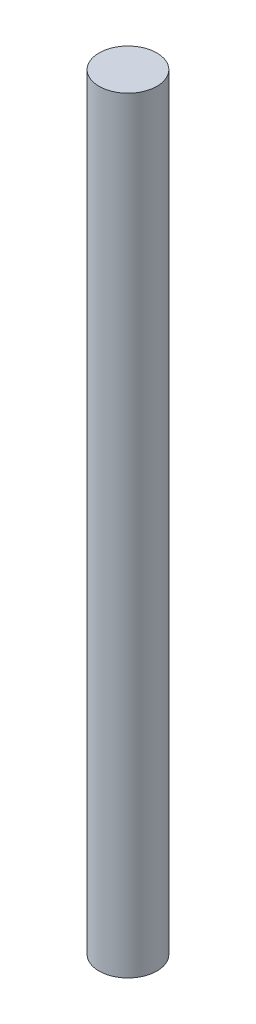
from build123d import *

# Parameters (mm, degrees)
SKETCH_1_R      = 4
EXTRUDE_1_DEPTH = 106


with BuildPart() as part:
    # 草图1 → 凸台-拉伸1 (new body)
    with BuildSketch(Plane(origin=(0, 0, 0), x_dir=(1, 0, 0), z_dir=(0, 1, 0))):
        with Locations(Location((0, 0, 0), (0, 0, 270))):
            Circle(SKETCH_1_R)
    extrude(amount=EXTRUDE_1_DEPTH)


solid = part.part
